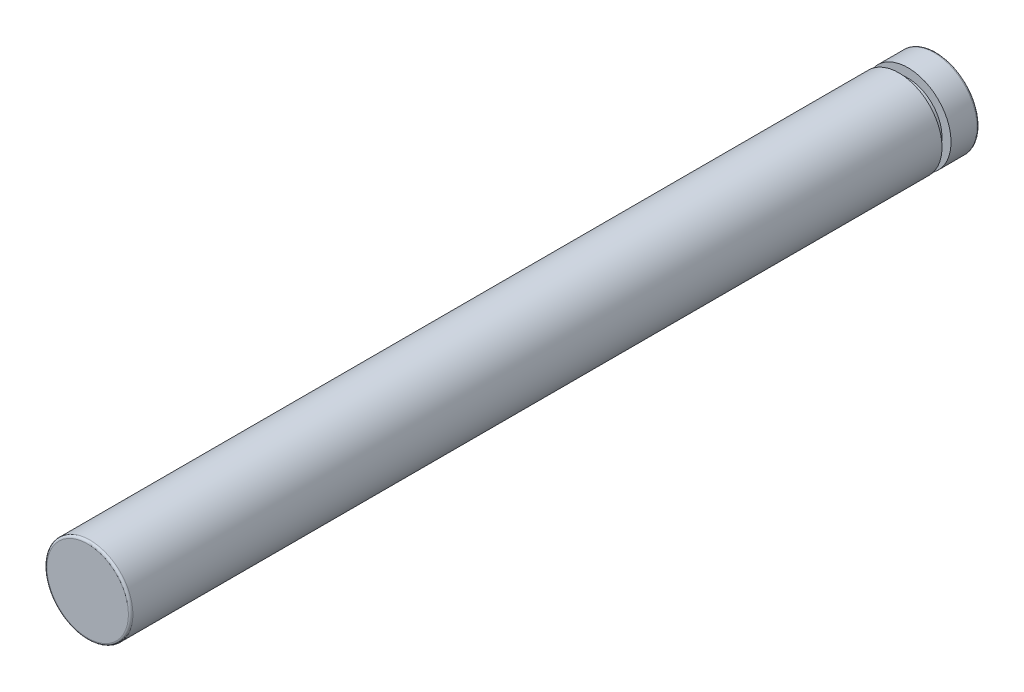
from build123d import *

# Parameters (mm, degrees)
SKETCH1_R           = 4.826
BOSS_EXTRUDE1_DEPTH = 47.625
SKETCH2_W           = 1.016
SKETCH2_H           = 1.016
FILLET1_R           = 0.254


with BuildPart() as part:
    # Sketch1 → Boss-Extrude1 (new, symmetric)
    with BuildSketch(Plane.XY):
        Circle(SKETCH1_R)
    extrude(amount=BOSS_EXTRUDE1_DEPTH, both=True)

    # Sketch2 → Cut-Revolve1 (revolve, cut)
    with BuildSketch(Plane(origin=(0, 0, 0), x_dir=(1, 0, 0), z_dir=(0, 1, 0))):
        with Locations((-4.318, 43.942)):
            Rectangle(SKETCH2_W, SKETCH2_H)
    revolve(axis=Axis((0, 0, -52.012367131), (0, 0, 1)), mode=Mode.SUBTRACT)

    # Fillet1
    fillet1_edges = [part.edges().sort_by_distance(p)[0] for p in [
        (-4.826, 0, -47.625),
        (-4.826, 0, 47.625),
    ]]
    fillet(fillet1_edges, radius=FILLET1_R)


solid = part.part
